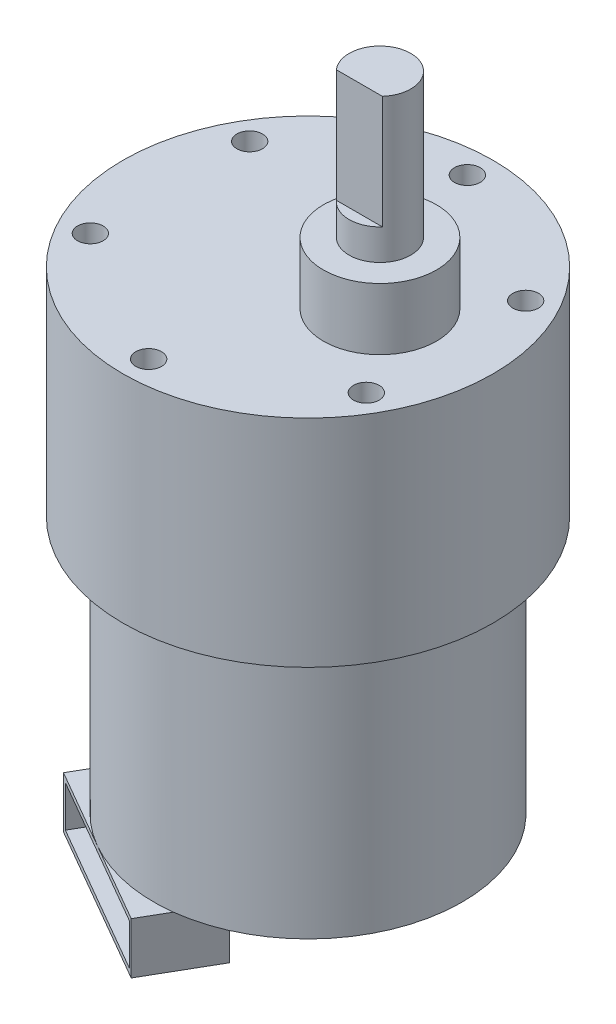
from build123d import *

# Parameters (mm, degrees)
SKETCH_1_R             = 15
EXTRUDE_1_DEPTH        = 25
SKETCH_2_R             = 18
EXTRUDE_2_DEPTH        = 21
SKETCH_3_R             = 5.5
EXTRUDE_3_DEPTH        = 6
SKETCH_4_R             = 3
EXTRUDE_4_DEPTH        = 14
CUT_EXTRUDE_START      = -11
CUT_EXTRUDE_1_DEPTH    = 11
HOLE_WIZARD_M3_1_D     = 2.5
HOLE_WIZARD_M3_1_DEPTH = 5.5
HOLE_WIZARD_M3_1_TIP   = 0.751075774
EXTRUDE_5_DEPTH        = 5
SKETCH_10_R            = 7
EXTRUDE_6_DEPTH        = 5
CUT_EXTRUDE_2_DEPTH    = 6
SKETCH_12_W            = 0.4
SKETCH_12_H            = 0.4
EXTRUDE_7_DEPTH        = 5


with BuildPart() as part:
    # 草图1 → 凸台-拉伸1 (new body)
    with BuildSketch(Plane(origin=(0, 0, 0), x_dir=(1, 0, 0), z_dir=(0, 1, 0))):
        with Locations(Location((0, 0, 0), (0, 0, 270))):
            Circle(SKETCH_1_R)
    extrude(amount=EXTRUDE_1_DEPTH)

    # 草图2 → 凸台-拉伸2 (add)
    with BuildSketch(Plane(origin=(0, 25, 0), x_dir=(1, 0, 0), z_dir=(0, 1, 0))):
        with Locations(Location((0, 0, 0), (0, 0, 90))):
            Circle(SKETCH_2_R)
    extrude(amount=EXTRUDE_2_DEPTH)

    # 草图3 → 凸台-拉伸3 (add)
    with BuildSketch(Plane(origin=(0, 46, 0), x_dir=(1, 0, 0), z_dir=(0, 1, 0))):
        with Locations(Location((7, 0, 0), (0, 0, 270))):
            Circle(SKETCH_3_R)
    extrude(amount=EXTRUDE_3_DEPTH)

    # 草图4 → 凸台-拉伸4 (add)
    with BuildSketch(Plane(origin=(0, 52, 0), x_dir=(1, 0, 0), z_dir=(0, 1, 0))):
        with Locations(Location((7, 0, 0), (0, 0, 270))):
            Circle(SKETCH_4_R)
    extrude(amount=EXTRUDE_4_DEPTH)

    # 草图5 → 切除-拉伸1 (cut)
    with BuildSketch(Plane(origin=(0, 66, 0), x_dir=(1, 0, 0), z_dir=(0, 1, 0)).offset(CUT_EXTRUDE_START)):
        with BuildLine():
            Line((9.236067977, -2), (4.763932023, -2))
            ThreePointArc((4.763932023, -2), (7, -3), (9.236067977, -2))
        make_face()
    extrude(amount=CUT_EXTRUDE_1_DEPTH, mode=Mode.SUBTRACT)

    # M3 螺纹孔1
    with Locations(Plane(origin=(0, 46, 0), x_dir=(1, 0, 0), z_dir=(0, 1, 0))):
        with Locations((0, 15.5), (-13.423393759, 7.75), (-13.423393759, -7.75), (0, -15.5), (13.423393759, -7.75), (13.423393759, 7.75)):
            Hole(HOLE_WIZARD_M3_1_D / 2, depth=HOLE_WIZARD_M3_1_DEPTH)
            with Locations((0, 0, -(HOLE_WIZARD_M3_1_DEPTH + HOLE_WIZARD_M3_1_TIP / 2))):  # 118° drill point
                Cone(0, HOLE_WIZARD_M3_1_D / 2, HOLE_WIZARD_M3_1_TIP, mode=Mode.SUBTRACT)

    # 草图9 → 凸台-拉伸5 (add)
    with BuildSketch(Plane.XZ):
        Polygon((-15.294228634, 8.490381057), (-11.794228634, 2.42820323), (3.794228634, 11.42820323), (0.294228634, 17.490381057), align=None)
    extrude(amount=EXTRUDE_5_DEPTH)

    # 草图10 → 凸台-拉伸6 (add)
    with BuildSketch(Plane.XZ):
        with Locations(Location((0, 0, 0), (0, 0, 90))):
            Circle(SKETCH_10_R)
    extrude(amount=EXTRUDE_6_DEPTH)

    # 草图11 → 切除-拉伸2 (cut)
    with BuildSketch(Plane(origin=(-7.5, 0, 12.990381057), x_dir=(0.8660254037844379, 0, 0.5000000000000013), z_dir=(-0.5000000000000013, 0, 0.8660254037844379))):
        Polygon((8.5, -0.5), (0, -0.5), (-8.5, -0.5), (-8.5, -4.5), (8.5, -4.5), align=None)
    extrude(amount=-CUT_EXTRUDE_2_DEPTH, mode=Mode.SUBTRACT)

    # 草图12 → 凸台-拉伸7 (add)
    with BuildSketch(Plane(origin=(-4.5, 0, 7.794228634), x_dir=(0.8660254037844379, 0, 0.5000000000000013), z_dir=(-0.5000000000000013, 0, 0.8660254037844379))):
        with Locations((-7.5, -2.5)):
            Rectangle(SKETCH_12_W, SKETCH_12_H)
        with Locations((-4.5, -2.5)):
            Rectangle(SKETCH_12_W, SKETCH_12_H)
        with Locations((-1.5, -2.5)):
            Rectangle(SKETCH_12_W, SKETCH_12_H)
        with Locations((1.5, -2.5)):
            Rectangle(SKETCH_12_W, SKETCH_12_H)
        with Locations((4.5, -2.5)):
            Rectangle(SKETCH_12_W, SKETCH_12_H)
        with Locations((7.5, -2.5)):
            Rectangle(SKETCH_12_W, SKETCH_12_H)
    extrude(amount=EXTRUDE_7_DEPTH)


solid = part.part
